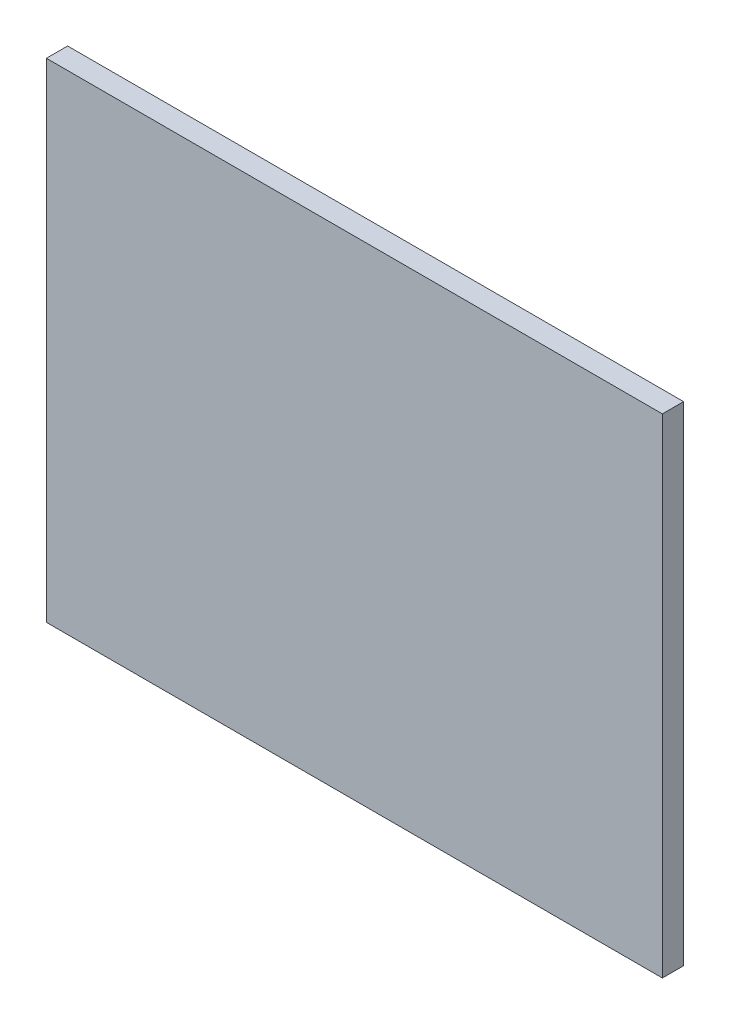
from build123d import *

# Parameters (mm, degrees)
SKETCH_1_W      = 290
SKETCH_1_H      = 230
EXTRUDE_1_DEPTH = 10
SKETCH_7_W      = 260
SKETCH_7_H      = 200
EXTRUDE_2_DEPTH = 10


with BuildPart() as part:
    # 草图1 → 凸台-拉伸1 (new body)
    with BuildSketch(Plane.XY):
        with Locations((145, 115)):
            Rectangle(SKETCH_1_W, SKETCH_1_H)
    extrude(amount=EXTRUDE_1_DEPTH)

    # 草图7 → 凸台-拉伸2 (add)
    with BuildSketch(Plane(origin=(0, 0, 0), x_dir=(-1, 0, 0), z_dir=(0, 0, -1))):
        with Locations((-145, 115)):
            Rectangle(SKETCH_7_W, SKETCH_7_H)
    extrude(amount=EXTRUDE_2_DEPTH)


solid = part.part
